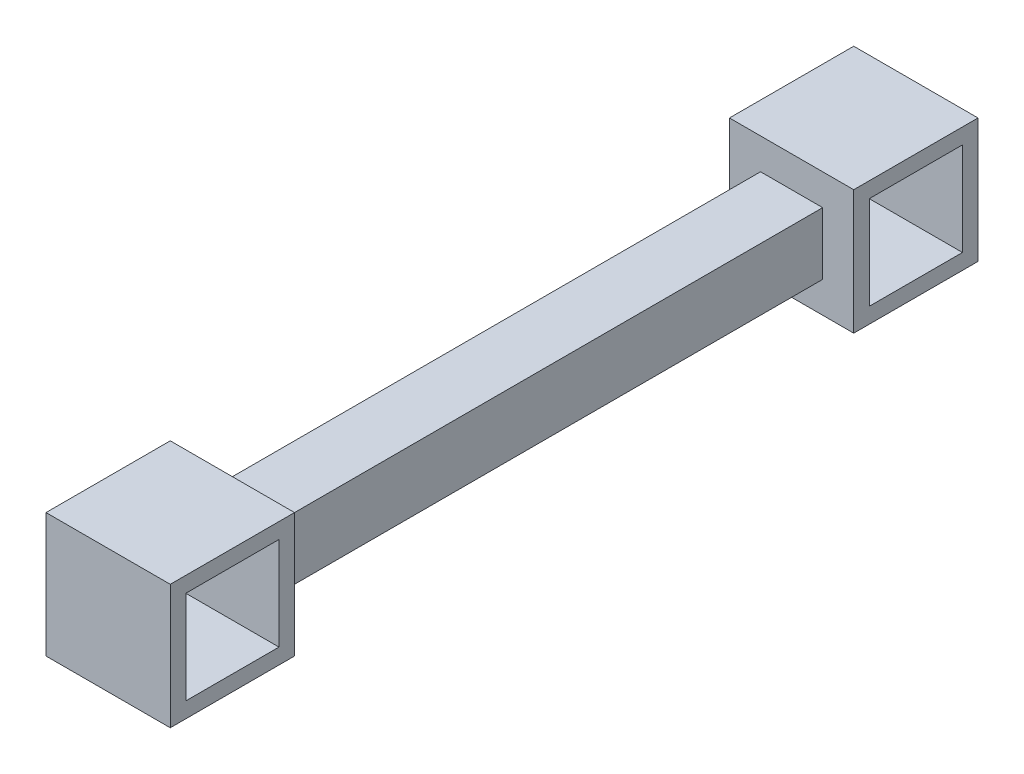
from build123d import *

# Parameters (mm, degrees)
SKETCH1_W           = 40
SKETCH1_H           = 40
BOSS_EXTRUDE1_DEPTH = 260
SKETCH3_W           = 40
SKETCH3_H           = 40
SKETCH3_W_2         = 20
SKETCH3_H_2         = 20
CUT_EXTRUDE1_DEPTH  = 180
SKETCH4_W           = 30
SKETCH4_H           = 30
CUT_EXTRUDE2_DEPTH  = 264.818119165


with BuildPart() as part:
    # Sketch1 → Boss-Extrude1 (new body)
    with BuildSketch(Plane.XY):
        Rectangle(SKETCH1_W, SKETCH1_H)
    extrude(amount=BOSS_EXTRUDE1_DEPTH)

    # Sketch3 → Cut-Extrude1 (cut)
    with BuildSketch(Plane.XY.offset(220)):
        Rectangle(SKETCH3_W, SKETCH3_H)
        Rectangle(SKETCH3_W_2, SKETCH3_H_2, mode=Mode.SUBTRACT)
    extrude(amount=-CUT_EXTRUDE1_DEPTH, mode=Mode.SUBTRACT)

    # Sketch4 → Cut-Extrude2 (cut, through all)
    with BuildSketch(Plane.ZY.offset(20)):
        with Locations((20, 0)):
            Rectangle(SKETCH4_W, SKETCH4_H)
        with Locations((240, 0)):
            Rectangle(SKETCH4_W, SKETCH4_H)
    extrude(amount=-CUT_EXTRUDE2_DEPTH, mode=Mode.SUBTRACT)


solid = part.part
